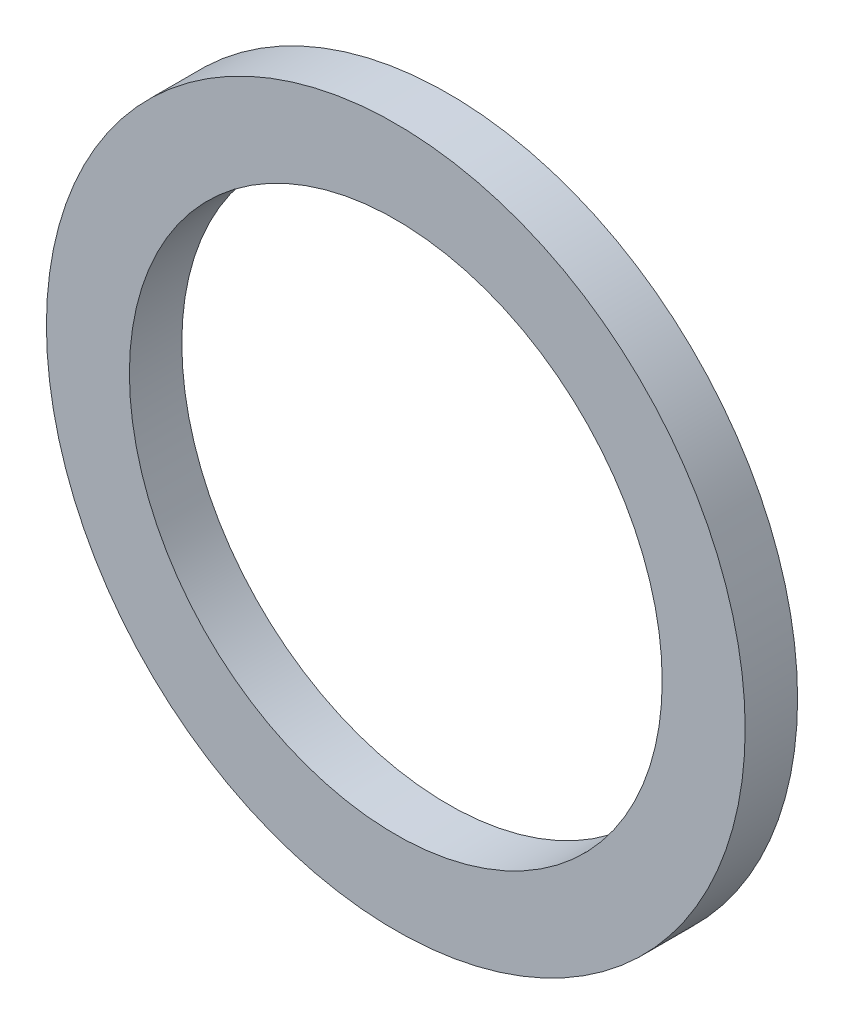
from build123d import *

# Parameters (mm, degrees)
INNER_RACE_SPACER_H0P3_START = 1.5
SKETCH1_R                    = 2
SKETCH1_R_2                  = 1.525
INNER_RACE_SPACER_H0P3_DEPTH = 0.3


with BuildPart() as part:
    # Sketch1 → Inner_Race_Spacer_H0p3 (new body)
    with BuildSketch(Plane.XY.offset(INNER_RACE_SPACER_H0P3_START)):
        Circle(SKETCH1_R)
        Circle(SKETCH1_R_2, mode=Mode.SUBTRACT)
    extrude(amount=INNER_RACE_SPACER_H0P3_DEPTH)


solid = part.part
